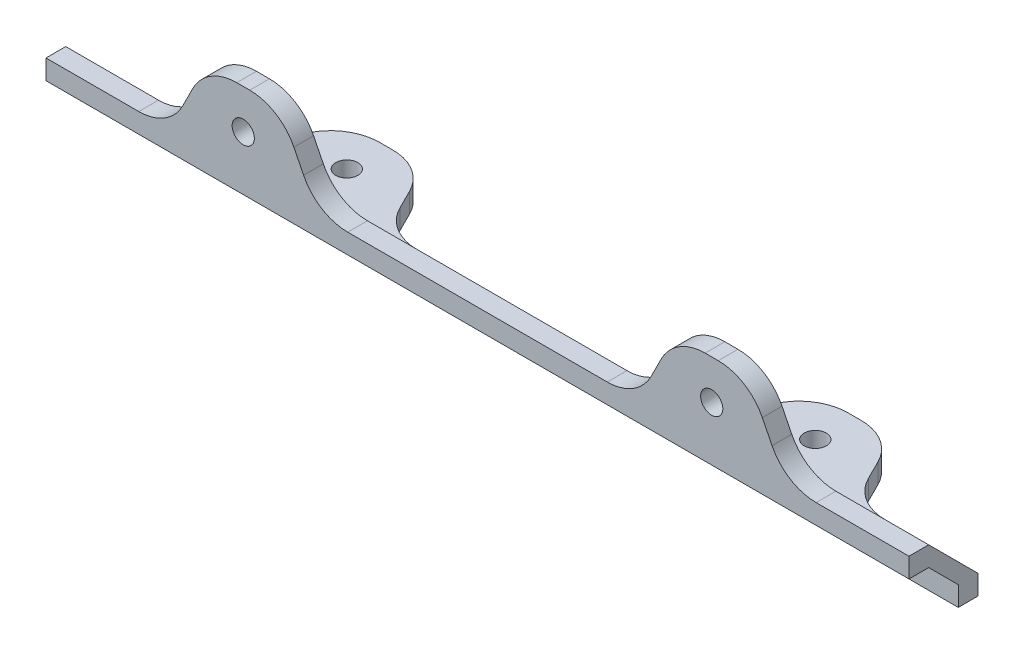
from build123d import *

# Parameters (mm, degrees)
ESTRUSIONE_ESTRUSIONE1_DEPTH = 175
ESTRUSIONE_ESTRUSIONE2_DEPTH = 4
ESTRUSIONE_ESTRUSIONE3_DEPTH = 4
RACCORDO1_R                  = 10
FORO_PER_VITE_M4_1_D         = 4.5
FORO_PER_VITE_M4_1_DEPTH     = 13
FORO_PER_VITE_M4_1_TIP       = 1.351936393
FORO_PER_VITE_M4_2_D         = 4.5
FORO_PER_VITE_M4_2_DEPTH     = 13
FORO_PER_VITE_M4_2_TIP       = 1.351936393


with BuildPart() as part:
    # Schizzo3 → Estrusione-Estrusione1 (new body)
    with BuildSketch(Plane(origin=(0, 0, 0), x_dir=(0, 0, -1), z_dir=(1, 0, 0))):
        Polygon((0, 0), (4, 0), (-6, 10), (-6, 6), align=None)
    extrude(amount=ESTRUSIONE_ESTRUSIONE1_DEPTH)

    # Schizzo4 → Estrusione-Estrusione2 (add)
    with BuildSketch(Plane.XZ):
        Polygon((25, -4), (32.5, -19), (47.5, -19), (55, -4), (120, -4), (127.5, -19), (142.5, -19), (150, -4), (175, -4), (175, 0), (0, 0), (0, -4), align=None)
    extrude(amount=ESTRUSIONE_ESTRUSIONE2_DEPTH)

    # Schizzo5 → Estrusione-Estrusione3 (add)
    with BuildSketch(Plane.XY.offset(6)):
        Polygon((0, 6), (0, 10), (25, 10), (32.5, 25), (47.5, 25), (55, 10), (120, 10), (127.5, 25), (142.5, 25), (150, 10), (175, 10), (175, 6), align=None)
    extrude(amount=ESTRUSIONE_ESTRUSIONE3_DEPTH)

    # Raccordo1
    raccordo1_edges = [part.edges().sort_by_distance(p)[0] for p in [
        (25, -2, -4),
        (32.5, -2, -19),
        (47.5, -2, -19),
        (55, -2, -4),
        (120, -2, -4),
        (127.5, -2, -19),
        (142.5, -2, -19),
        (150, -2, -4),
        (150, 10, 8),
        (142.5, 25, 8),
        (127.5, 25, 8),
        (120, 10, 8),
        (55, 10, 8),
        (47.5, 25, 8),
        (32.5, 25, 8),
        (25, 10, 8),
    ]]
    fillet(raccordo1_edges, radius=RACCORDO1_R)

    # Foro per Vite M4-1
    with Locations(Plane(origin=(0, 0, 0), x_dir=(1, 0, 0), z_dir=(0, 1, 0))):
        with Locations((135, 11), (40, 11)):
            Hole(FORO_PER_VITE_M4_1_D / 2, depth=FORO_PER_VITE_M4_1_DEPTH)
            with Locations((0, 0, -(FORO_PER_VITE_M4_1_DEPTH + FORO_PER_VITE_M4_1_TIP / 2))):  # 118° drill point
                Cone(0, FORO_PER_VITE_M4_1_D / 2, FORO_PER_VITE_M4_1_TIP, mode=Mode.SUBTRACT)

    # Foro per Vite M4-2
    with Locations(Plane(origin=(0, 0, 6), x_dir=(-1, 0, 0), z_dir=(0, 0, -1))):
        with Locations((-40, 17), (-135, 17)):
            Hole(FORO_PER_VITE_M4_2_D / 2, depth=FORO_PER_VITE_M4_2_DEPTH)
            with Locations((0, 0, -(FORO_PER_VITE_M4_2_DEPTH + FORO_PER_VITE_M4_2_TIP / 2))):  # 118° drill point
                Cone(0, FORO_PER_VITE_M4_2_D / 2, FORO_PER_VITE_M4_2_TIP, mode=Mode.SUBTRACT)


solid = part.part
